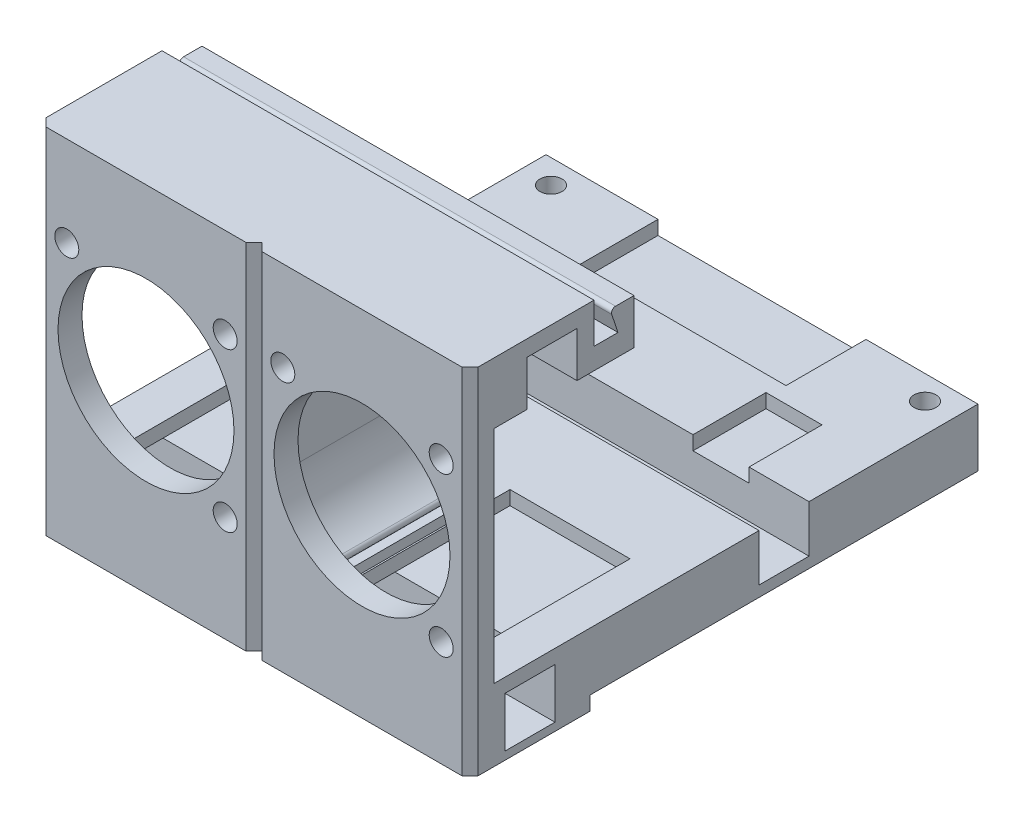
from build123d import *

# Parameters (mm, degrees)
SKETCH1_W           = 54
SKETCH1_H           = 63.5
SKETCH1_R           = 1.375
BOSS_EXTRUDE1_DEPTH = 9
SKETCH2_W           = 54
SKETCH2_H           = 3
BOSS_EXTRUDE2_DEPTH = 35.25
SKETCH3_R           = 11
SKETCH3_R_2         = 1.5
CUT_EXTRUDE1_DEPTH  = 82.9714127
SKETCH4_W           = 54
SKETCH4_H           = 48.5
CUT_EXTRUDE2_DEPTH  = 1.75
BOSS_EXTRUDE3_DEPTH = 17.5
SKETCH6_W           = 54
SKETCH6_H           = 7.65
BOSS_EXTRUDE5_DEPTH = 17.5
FILLET2_R           = 3
SKETCH8_W           = 15
SKETCH8_H           = 22
SKETCH8_W_2         = 7
SKETCH8_H_2         = 10
CUT_EXTRUDE4_DEPTH  = 1.75
SKETCH7_W           = 6.25
SKETCH7_H           = 6.25
SKETCH7_H_2         = 5.9
CUT_EXTRUDE3_DEPTH  = 77.695012876
CHAMFER2_SIZE       = 1
CUT_EXTRUDE5_DEPTH  = 61.787539842
CUT_EXTRUDE6_DEPTH  = 77.695012876
BOSS_EXTRUDE6_START = 0.2
SKETCH13_W          = 8.680886663
SKETCH13_H          = 18.174047098
BOSS_EXTRUDE6_DEPTH = 1.2


with BuildPart() as part:
    # Sketch1 → Boss-Extrude1 (new body)
    with BuildSketch(Plane(origin=(0, 0, 0), x_dir=(1, 0, 0), z_dir=(0, 1, 0))):
        Rectangle(SKETCH1_W, SKETCH1_H)
        with Locations(Location((-23.375, 28.75, 0), (0, 0, 270))):
            Circle(SKETCH1_R, mode=Mode.SUBTRACT)
        with Locations(Location((23.375, 28.75, 0), (0, 0, 270))):
            Circle(SKETCH1_R, mode=Mode.SUBTRACT)
        with Locations(Location((0, -5.5, 0), (0, 0, 270))):
            Circle(SKETCH1_R, mode=Mode.SUBTRACT)
    extrude(amount=BOSS_EXTRUDE1_DEPTH)

    # Sketch2 → Boss-Extrude2 (add)
    with BuildSketch(Plane(origin=(0, 9, 0), x_dir=(1, 0, 0), z_dir=(0, 1, 0))):
        with Locations((0, -30.25)):
            Rectangle(SKETCH2_W, SKETCH2_H)
    extrude(amount=BOSS_EXTRUDE2_DEPTH)

    # Sketch3 → Cut-Extrude1 (cut, through all)
    with BuildSketch(Plane.XY.offset(31.75)):
        with Locations((-13.5, 23.1)):
            Circle(SKETCH3_R)
        with Locations((13.5, 23.1)):
            Circle(SKETCH3_R)
        with Locations((-23.4, 33)):
            Circle(SKETCH3_R_2)
        with Locations((-3.6, 13.2)):
            Circle(SKETCH3_R_2)
        with Locations((3.6, 33)):
            Circle(SKETCH3_R_2)
        with Locations((23.4, 13.2)):
            Circle(SKETCH3_R_2)
        with Locations((-3.6, 33)):
            Circle(SKETCH3_R_2)
        with Locations((23.4, 33)):
            Circle(SKETCH3_R_2)
    extrude(amount=-CUT_EXTRUDE1_DEPTH, mode=Mode.SUBTRACT)

    # Sketch4 → Cut-Extrude2 (cut)
    with BuildSketch(Plane(origin=(0, 0, 0), x_dir=(-1, 0, 0), z_dir=(0, -1, 0))):
        with Locations((0, 7.5)):
            Rectangle(SKETCH4_W, SKETCH4_H)
    extrude(amount=-CUT_EXTRUDE2_DEPTH, mode=Mode.SUBTRACT)

    # Sketch5 → Boss-Extrude3 (add)
    with BuildSketch(Plane(origin=(0, 0, 28.75), x_dir=(-1, 0, 0), z_dir=(0, 0, -1))):
        with BuildLine():
            Line((-1.25, 23.1), (-1.25, 29.841281906))
            ThreePointArc((-1.25, 29.841281906), (-1.147384506, 30.849064124), (-0.84375, 31.815480715))
            ThreePointArc((-0.84375, 31.815480715), (-0.661569296, 32.395330669), (-0.6, 33))
            Line((-0.6, 33), (-0.6, 36.6))
            Line((-0.6, 36.6), (9.4, 36.6))
            ThreePointArc((9.4, 36.6), (7.396552209, 35.65403434), (5.601157986, 34.355876542))
            ThreePointArc((5.601157986, 34.355876542), (5.018547742, 34.111551246), (4.405752691, 34.265212473))
            ThreePointArc((4.405752691, 34.265212473), (2.414687889, 33.919257961), (2.575108687, 31.90473848))
            ThreePointArc((2.575108687, 31.90473848), (2.876434451, 31.349461675), (2.784782595, 30.724378093))
            ThreePointArc((2.784782595, 30.724378093), (1.825613317, 28.09859937), (1.5, 25.322145594))
            Line((1.5, 25.322145594), (1.5, 23.1))
            Line((1.5, 23.1), (1.5, 16.886461718))
            ThreePointArc((1.5, 16.886461718), (1.357339807, 15.700607596), (0.9375, 14.582423144))
            ThreePointArc((0.9375, 14.582423144), (0.685596116, 13.911512474), (0.6, 13.2))
            Line((0.6, 13.2), (0.6, 10.6))
            Line((0.6, 10.6), (0, 10.6))
            Line((0, 10.6), (-5.816699867, 10.6))
            ThreePointArc((-5.816699867, 10.6), (-6.30299863, 10.983752361), (-6.042824199, 11.545945946))
            ThreePointArc((-6.042824199, 11.545945946), (-2.543868689, 14.770850967), (-1.25, 19.35))
            Line((-1.25, 19.35), (-1.25, 23.1))
        make_face()
    extrude(amount=BOSS_EXTRUDE3_DEPTH)

    # Sketch6 → Boss-Extrude5 (add)
    with BuildSketch(Plane(origin=(0, 0, 28.75), x_dir=(-1, 0, 0), z_dir=(0, 0, -1))):
        with Locations((0, 40.425)):
            Rectangle(SKETCH6_W, SKETCH6_H)
    extrude(amount=BOSS_EXTRUDE5_DEPTH)

    # Fillet2
    fillet2_edges = [part.edges().sort_by_distance(p)[0] for p in [
        (-9.4, 36.6, 20),
        (0.6, 36.6, 20),
    ]]
    fillet(fillet2_edges, radius=FILLET2_R)

    # Sketch8 → Cut-Extrude4 (cut)
    with BuildSketch(Plane(origin=(0, 9, 0), x_dir=(1, 0, 0), z_dir=(0, 1, 0))):
        with Locations((14.5, -17.75)):
            Rectangle(SKETCH8_W, SKETCH8_H)
        with Locations((-14.5, -17.75)):
            Rectangle(SKETCH8_W, SKETCH8_H)
        Polygon((-13, 31.75), (13, 31.75), (13, 21.75), (0, 21.75), (-13, 21.75), align=None)
        with Locations((16, 14.75)):
            Rectangle(SKETCH8_W_2, SKETCH8_H_2)
    extrude(amount=-CUT_EXTRUDE4_DEPTH, mode=Mode.SUBTRACT)

    # Sketch7 → Cut-Extrude3 (cut, through all)
    with BuildSketch(Plane(origin=(27, 0, 0), x_dir=(0, 0, -1), z_dir=(1, 0, 0))):
        with Locations((-24.25, 4.125)):
            Rectangle(SKETCH7_W, SKETCH7_H)
        with Locations((-21.5, 39.125)):
            Rectangle(SKETCH7_W, SKETCH7_H)
        with Locations((7.5, 6.05)):
            Rectangle(SKETCH7_W, SKETCH7_H_2)
    extrude(amount=-CUT_EXTRUDE3_DEPTH, mode=Mode.SUBTRACT)

    # Chamfer2
    chamfer2_edges = [part.edges().sort_by_distance(p)[0] for p in [
        (27, 22.125, 31.75),
        (-27, 22.125, 31.75),
    ]]
    chamfer(chamfer2_edges, length=CHAMFER2_SIZE)

    # Sketch9 → Cut-Extrude5 (cut, through all)
    with BuildSketch(Plane(origin=(0, 44.25, 0), x_dir=(1, 0, 0), z_dir=(0, 1, 0))):
        Polygon((-1, -31.75), (0, -30.75), (1, -31.75), align=None)
    extrude(amount=-CUT_EXTRUDE5_DEPTH, mode=Mode.SUBTRACT)

    # Sketch10 → Cut-Extrude6 (cut, through all)
    with BuildSketch(Plane(origin=(27, 0, 0), x_dir=(0, 0, -1), z_dir=(1, 0, 0))):
        with BuildLine():
            Line((-11.25, 44.25), (-16.25, 44.25))
            Line((-16.25, 44.25), (-16.25, 39.25))
            Line((-16.25, 39.25), (-13.25, 39.25))
            Line((-13.25, 39.25), (-14.030628706, 41.591886117))
            ThreePointArc((-14.030628706, 41.591886117), (-13.961908149, 42.042355142), (-13.556287057, 42.25))
            Line((-13.556287057, 42.25), (-11.25, 42.25))
            Line((-11.25, 42.25), (-11.25, 44.25))
        make_face()
    extrude(amount=-CUT_EXTRUDE6_DEPTH, mode=Mode.SUBTRACT)


with BuildPart() as body_2:
    # Sketch13 → Boss-Extrude6 (new body)
    with BuildSketch(Plane(origin=(0, 9, 0), x_dir=(1, 0, 0), z_dir=(0, 1, 0)).offset(BOSS_EXTRUDE6_START)):
        with Locations((2.659556669, -19.282754062)):
            Rectangle(SKETCH13_W, SKETCH13_H)
    extrude(amount=BOSS_EXTRUDE6_DEPTH)


solid = Compound([part.part, body_2.part])
